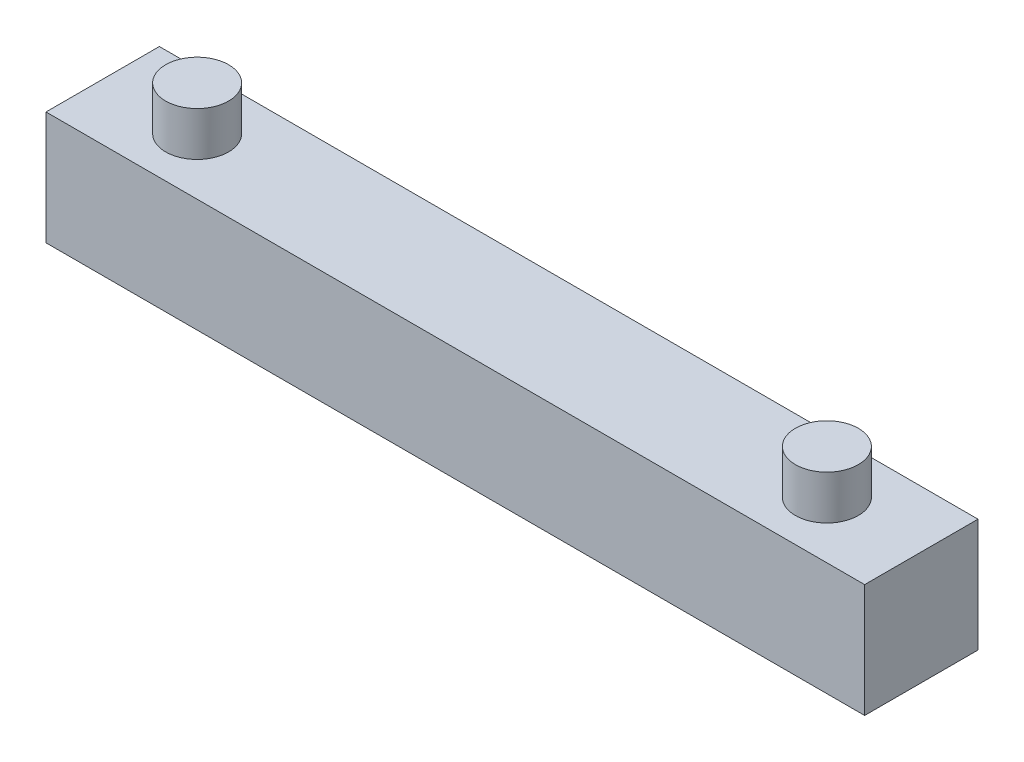
from build123d import *

# Parameters (mm, degrees)
SKETCH_1_W      = 65
SKETCH_1_H      = 9
EXTRUDE_1_DEPTH = 9
SKETCH_2_R      = 2.5
EXTRUDE_2_DEPTH = 3.5


with BuildPart() as part:
    # 草圖1 → 填料-伸長1 (new body)
    with BuildSketch(Plane(origin=(0, 0, 0), x_dir=(1, 0, 0), z_dir=(0, 1, 0))):
        Rectangle(SKETCH_1_W, SKETCH_1_H)
    extrude(amount=EXTRUDE_1_DEPTH)

    # 草圖2 → 填料-伸長2 (add)
    with BuildSketch(Plane(origin=(0, 9, 0), x_dir=(1, 0, 0), z_dir=(0, 1, 0))):
        with Locations(Location((-25, 0, 0), (0, 0, 90))):
            Circle(SKETCH_2_R)
        with Locations(Location((25, 0, 0), (0, 0, 90))):
            Circle(SKETCH_2_R)
    extrude(amount=EXTRUDE_2_DEPTH)


solid = part.part
